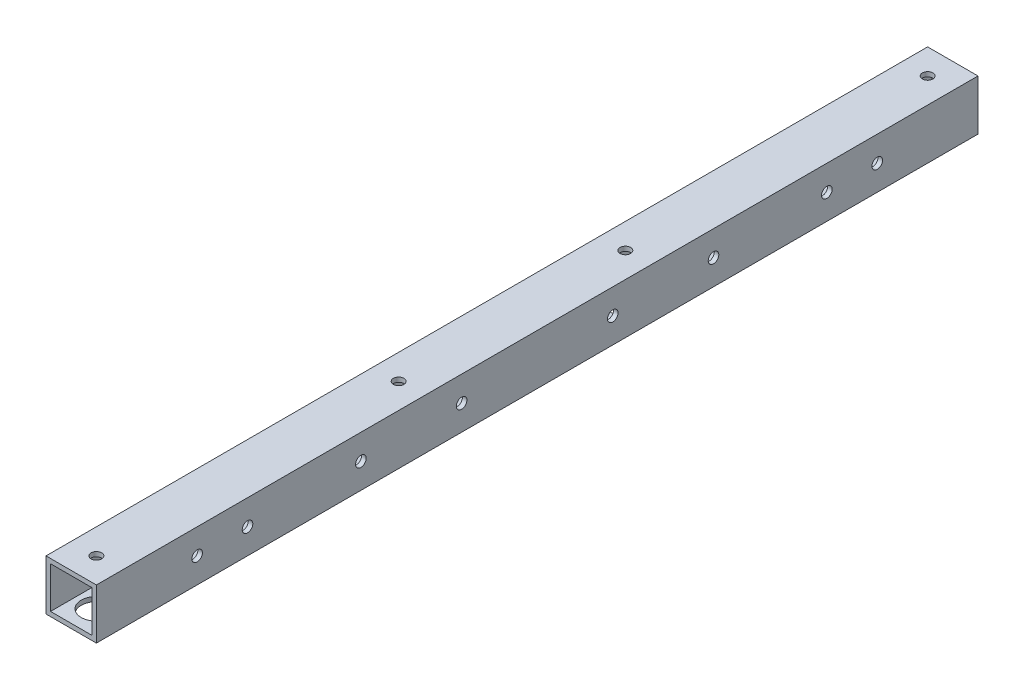
from build123d import *

# Parameters (mm, degrees)
SKETCH_3_W              = 20
SKETCH_3_H              = 20
SKETCH_3_W_2            = 16.4
SKETCH_3_H_2            = 16.4
EXTRUDE_1_DEPTH         = 350
HOLE_WIZARD_4_2_4_2_1_D = 4.2
HOLE_WIZARD_4_2_4_2_2_D = 4.2
CUT_EXTRUDE_2_REACH     = 353.141
SKETCH_11_R             = 6
HOLE_WIZARD_4_2_4_2_4_D = 4.2
HOLE_WIZARD_4_2_4_2_5_D = 4.2
CUT_EXTRUDE_3_REACH     = 353.141
SKETCH_16_R             = 6


with BuildPart() as part:
    # 草图3 → 凸台-拉伸1 (new body)
    with BuildSketch(Plane.XY):
        with Locations((10, 10)):
            Rectangle(SKETCH_3_W, SKETCH_3_H)
        with Locations((10, 10)):
            Rectangle(SKETCH_3_W_2, SKETCH_3_H_2, mode=Mode.SUBTRACT)
    extrude(amount=-EXTRUDE_1_DEPTH)

    # Ø4.2 (4.2) 直径孔1 (through all)
    with Locations(Plane(origin=(20, 10, -60), x_dir=(0, 1, 0), z_dir=(1, 0, 0))):
        with Locations((0, 0), (0, 20)):
            hole_wizard_4_2_4_2_1 = Hole(HOLE_WIZARD_4_2_4_2_1_D / 2)

    # 镜向1: Ø4.2 (4.2) 直径孔1 across plane
    add(hole_wizard_4_2_4_2_1.mirror(Plane.XY.offset(-175)), mode=Mode.SUBTRACT)

    # Ø4.2 (4.2) 直径孔2 (through all)
    with Locations(Plane(origin=(20, 10, -145), x_dir=(0, 1, 0), z_dir=(1, 0, 0))):
        with Locations((0, 0), (0, 40)):
            hole_wizard_4_2_4_2_2 = Hole(HOLE_WIZARD_4_2_4_2_2_D / 2)

    # 镜向2: Ø4.2 (4.2) 直径孔2 across plane
    add(hole_wizard_4_2_4_2_2.mirror(Plane.XY.offset(-175)), mode=Mode.SUBTRACT)

    # 草图11 → 切除-拉伸2 (cut, up to next)
    with BuildSketch(Plane.XZ, mode=Mode.PRIVATE) as cut_extrude_2_sk1:
        with Locations(Location((10, -10, 0), (0, 0, 270))):
            Circle(SKETCH_11_R)
    cut_extrude_2_tool1 = extrude(cut_extrude_2_sk1.sketch, amount=-CUT_EXTRUDE_2_REACH, mode=Mode.PRIVATE) & part.part
    # 草图11 → 切除-拉伸2 (cut, up to next)
    with BuildSketch(Plane.XZ, mode=Mode.PRIVATE) as cut_extrude_2_sk2:
        with Locations(Location((10, -340, 0), (0, 0, 270))):
            Circle(SKETCH_11_R)
    cut_extrude_2_tool2 = extrude(cut_extrude_2_sk2.sketch, amount=-CUT_EXTRUDE_2_REACH, mode=Mode.PRIVATE) & part.part
    add(cut_extrude_2_tool1.solids().sort_by_distance((10, 0, -10))[0], mode=Mode.SUBTRACT)
    add(cut_extrude_2_tool2.solids().sort_by_distance((10, 0, -340))[0], mode=Mode.SUBTRACT)

    # Ø4.2 (4.2) 直径孔4 (through all)
    with Locations(Plane(origin=(10, 20, -340), x_dir=(0, 0, 1), z_dir=(0, 1, 0))):
        with Locations((0, 0), (330, 0)):
            Hole(HOLE_WIZARD_4_2_4_2_4_D / 2)

    # Ø4.2 (4.2) 直径孔5 (through all)
    with Locations(Plane(origin=(10, 20, -220), x_dir=(0, 0, 1), z_dir=(0, 1, 0))):
        with Locations((0, 0), (90, 0)):
            Hole(HOLE_WIZARD_4_2_4_2_5_D / 2)

    # 草图16 → 切除-拉伸3 (cut, up to next)
    with BuildSketch(Plane.XZ, mode=Mode.PRIVATE) as cut_extrude_3_sk1:
        with Locations(Location((10, -130, 0), (0, 0, 270))):
            Circle(SKETCH_16_R)
    cut_extrude_3_tool1 = extrude(cut_extrude_3_sk1.sketch, amount=-CUT_EXTRUDE_3_REACH, mode=Mode.PRIVATE) & part.part
    # 草图16 → 切除-拉伸3 (cut, up to next)
    with BuildSketch(Plane.XZ, mode=Mode.PRIVATE) as cut_extrude_3_sk2:
        with Locations(Location((10, -220, 0), (0, 0, 270))):
            Circle(SKETCH_16_R)
    cut_extrude_3_tool2 = extrude(cut_extrude_3_sk2.sketch, amount=-CUT_EXTRUDE_3_REACH, mode=Mode.PRIVATE) & part.part
    add(cut_extrude_3_tool1.solids().sort_by_distance((10, 0, -130))[0], mode=Mode.SUBTRACT)
    add(cut_extrude_3_tool2.solids().sort_by_distance((10, 0, -220))[0], mode=Mode.SUBTRACT)


solid = part.part
